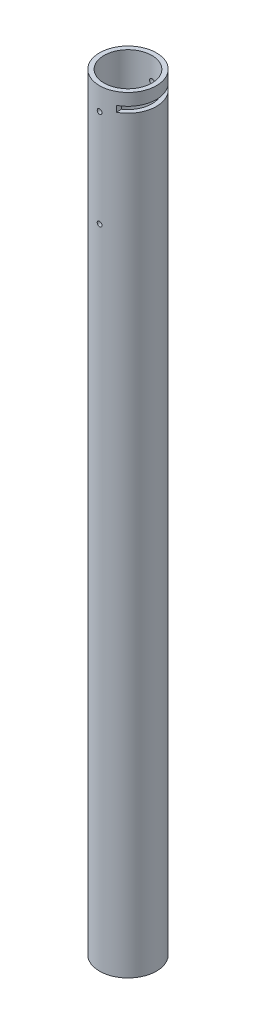
from build123d import *

# Parameters (mm, degrees)
SKETCH1_R               = 30.1625
SKETCH1_R_2             = 25.4
BOSS_EXTRUDE1_DEPTH     = 812.8
CUT_EXTRUDE2_DEPTH      = 814.918541878
CUT_EXTRUDE2_DEPTH_BACK = 814.918541878
SKETCH4_R               = 2.54
SKETCH4_W               = 15.875
SKETCH4_H               = 6.35


with BuildPart() as part:
    # Sketch1 → Boss-Extrude1 (new body)
    with BuildSketch(Plane(origin=(0, 0, 0), x_dir=(1, 0, 0), z_dir=(0, 1, 0))):
        with Locations(Location((0, 0, 0), (0, 0, 270))):
            Circle(SKETCH1_R)
        with Locations(Location((0, 0, 0), (0, 0, 270))):
            Circle(SKETCH1_R_2, mode=Mode.SUBTRACT)
    extrude(amount=BOSS_EXTRUDE1_DEPTH)

    # Sketch4 → Cut-Extrude2 (cut, two sides: drawn at the far end of the back side and taken through both)
    with BuildSketch(Plane.XY.offset(-CUT_EXTRUDE2_DEPTH_BACK)):
        with Locations((0, 685.8)):
            Circle(SKETCH4_R)
        with Locations((0, 788.9875)):
            Circle(SKETCH4_R)
        with Locations((22.225, 796.925)):
            Rectangle(SKETCH4_W, SKETCH4_H)
    extrude(amount=CUT_EXTRUDE2_DEPTH + CUT_EXTRUDE2_DEPTH_BACK, mode=Mode.SUBTRACT)


solid = part.part
